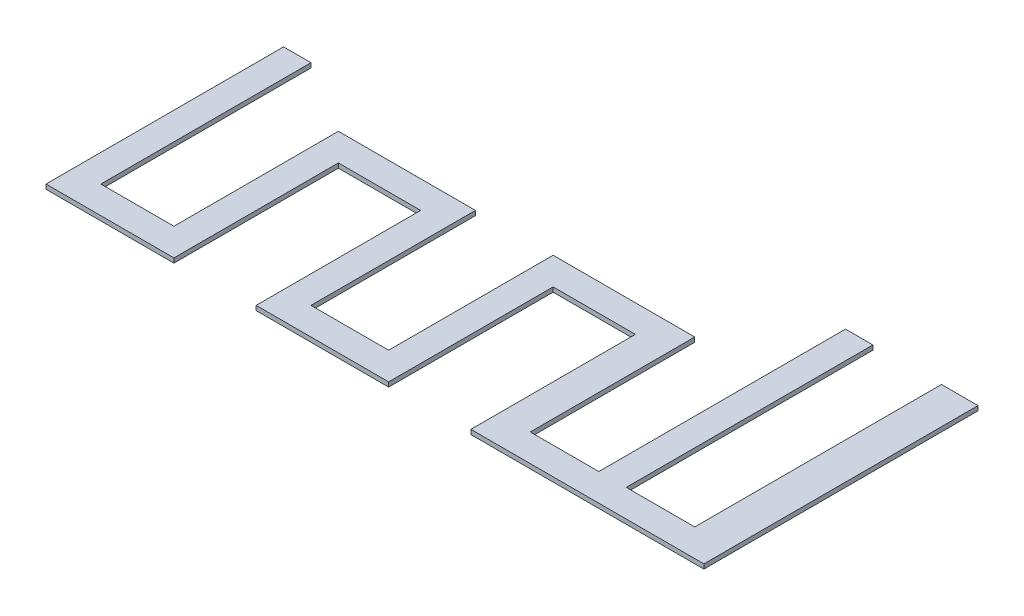
from build123d import *

# Parameters (mm, degrees)
SKETCH1_R           = 1.5875
BOSS_EXTRUDE1_DEPTH = 1.65
SKETCH2_R           = 0.4
CUT_EXTRUDE1_DEPTH  = 1.65
SKETCH3_R           = 0.4
CUT_EXTRUDE2_DEPTH  = 1.65
LPATTERN1_COUNT     = 15
LPATTERN1_PITCH     = 2.54
SKETCH4_R           = 0.4
CUT_EXTRUDE3_DEPTH  = 1.65
LPATTERN2_COUNT     = 10
LPATTERN2_PITCH     = 2.54
EXTRUDE_1_DEPTH     = 0.1
SKETCH_2_W          = 71.696119323
SKETCH_2_H          = 83.90888514
CUT_EXTRUDE_1_DEPTH = 87.897033896


with BuildPart() as part:
    # Sketch1 → Boss-Extrude1 (new body)
    with BuildSketch(Plane(origin=(0, 0, 0), x_dir=(1, 0, 0), z_dir=(0, 1, 0))):
        Polygon((0, 0), (-53.34, 0), (-53.34, 66.04), (-40.386, 66.04), (-37.846, 68.58), (-5.08, 68.58), (-2.54, 66.04), (0, 66.04), align=None)
        with Locations(Location((-7.62, 66.04, 0), (0, 0, 270))):
            Circle(SKETCH1_R, mode=Mode.SUBTRACT)
        with Locations(Location((-35.56, 66.04, 0), (0, 0, 270))):
            Circle(SKETCH1_R, mode=Mode.SUBTRACT)
        with Locations(Location((-2.54, 13.97, 0), (0, 0, 270))):
            Circle(SKETCH1_R, mode=Mode.SUBTRACT)
        with Locations(Location((-50.8, 15.24, 0), (0, 0, 270))):
            Circle(SKETCH1_R, mode=Mode.SUBTRACT)
    extrude(amount=-BOSS_EXTRUDE1_DEPTH)

    # Sketch2 → Cut-Extrude1 (cut)
    with BuildSketch(Plane(origin=(0, 0, 0), x_dir=(1, 0, 0), z_dir=(0, 1, 0))):
        with Locations(Location((-2.54, 27.94, 0), (0, 0, 270))):
            Circle(SKETCH2_R)
    cut_extrude1 = extrude(amount=-CUT_EXTRUDE1_DEPTH, mode=Mode.SUBTRACT)

    # Sketch3 → Cut-Extrude2 (cut)
    with BuildSketch(Plane(origin=(0, 0, 0), x_dir=(1, 0, 0), z_dir=(0, 1, 0))):
        with Locations(Location((-50.8, 18.796, 0), (0, 0, 270))):
            Circle(SKETCH3_R)
    cut_extrude2 = extrude(amount=-CUT_EXTRUDE2_DEPTH, mode=Mode.SUBTRACT)

    # LPattern1: Cut-Extrude1 ×15, 1 skipped
    with Locations(*[(0, 0, -i * LPATTERN1_PITCH) for i in range(1, LPATTERN1_COUNT) if i not in (8,)]):
        add(cut_extrude1, mode=Mode.SUBTRACT)

    # Sketch4 → Cut-Extrude3 (cut)
    with BuildSketch(Plane(origin=(0, 0, 0), x_dir=(1, 0, 0), z_dir=(0, 1, 0))):
        with Locations(Location((-50.8, 45.72, 0), (0, 0, 270))):
            Circle(SKETCH4_R)
    extrude(amount=-CUT_EXTRUDE3_DEPTH, mode=Mode.SUBTRACT)

    # LPattern2: Cut-Extrude2 ×10
    with Locations(*[(0, 0, -i * LPATTERN2_PITCH) for i in range(1, LPATTERN2_COUNT)]):
        add(cut_extrude2, mode=Mode.SUBTRACT)

    # 草图2 → 切除-拉伸1 (cut, through all)
    with BuildSketch(Plane(origin=(0, 0, 0), x_dir=(1, 0, 0), z_dir=(0, 1, 0))):
        with Locations((-23.858381216, 34.717351285)):
            Rectangle(SKETCH_2_W, SKETCH_2_H)
    extrude(amount=-CUT_EXTRUDE_1_DEPTH, mode=Mode.SUBTRACT)


with BuildPart() as body_2:
    # 草图1 → 凸台-拉伸1 (new body)
    with BuildSketch(Plane(origin=(0, 0, 0), x_dir=(1, 0, 0), z_dir=(0, 1, 0))):
        Polygon((-37.34, -11.757389562), (-37.34, -16.957389562), (-34.54, -16.957389562), (-34.54, -13.357389562), (-32.74, -13.357389562), (-32.74, -16.957389562), (-29.84, -16.957389562), (-29.84, -13.357389562), (-28.04, -13.357389562), (-28.04, -16.957389562), (-22.94, -16.957389562), (-22.94, -10.957389562), (-23.74, -10.957389562), (-23.74, -16.357389562), (-25.24, -16.357389562), (-25.24, -10.957389562), (-25.84, -10.957389562), (-25.84, -16.357389562), (-27.34, -16.357389562), (-27.34, -12.757389562), (-30.44, -12.757389562), (-30.44, -16.357389562), (-32.14, -16.357389562), (-32.14, -12.757389562), (-35.14, -12.757389562), (-35.14, -16.357389562), (-36.74, -16.357389562), (-36.74, -11.757389562), align=None)
    extrude(amount=EXTRUDE_1_DEPTH)


solid = body_2.part
